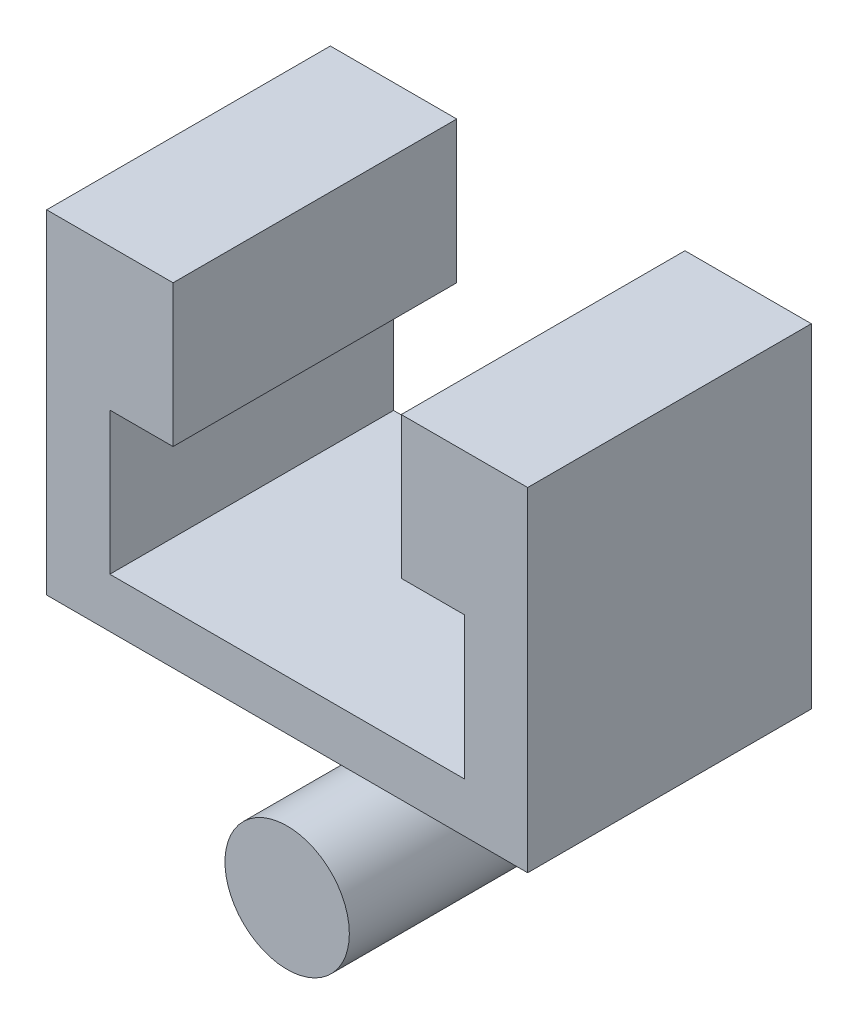
from build123d import *

# Parameters (mm, degrees)
BOSS_EXTRUDE1_DEPTH = 2.521826736
SKETCH2_R           = 11.136118556
BOSS_EXTRUDE2_DEPTH = 50.8
SKETCH3_W           = 86.137031446
SKETCH3_H           = 59.748072355
BOSS_EXTRUDE3_DEPTH = 50.8
CUT_EXTRUDE1_DEPTH  = 109.100560925


with BuildPart() as part:
    # Sketch1 → Boss-Extrude1 (new body)
    with BuildSketch(Plane.XY):
        with BuildLine():
            Line((-11.136118556, 0), (-11.136118556, 25.4))
            Line((-11.136118556, 25.4), (11.136118556, 25.4))
            Line((11.136118556, 25.4), (11.136118556, 0))
            ThreePointArc((11.136118556, 0), (0, 11.136118556), (-11.136118556, 0))
        make_face()
    boss_extrude1 = extrude(amount=BOSS_EXTRUDE1_DEPTH)

    # Sketch2 → Boss-Extrude2 (add)
    with BuildSketch(Plane.XY):
        Circle(SKETCH2_R)
    extrude(amount=BOSS_EXTRUDE2_DEPTH)

    # Sketch3 → Boss-Extrude3 (add)
    with BuildSketch(Plane.XY):
        with Locations((0, 55.274036178)):
            Rectangle(SKETCH3_W, SKETCH3_H)
    extrude(amount=BOSS_EXTRUDE3_DEPTH)

    # Sketch4 → Cut-Extrude1 (cut, through all)
    with BuildSketch(Plane.XY.offset(50.8)):
        Polygon((20.431484277, 85.148072355), (20.431484277, 59.748072355), (31.75, 59.748072355), (31.75, 34.29), (-31.75, 34.29), (-31.75, 59.748072355), (-20.431484277, 59.748072355), (-20.431484277, 85.148072355), align=None)
    extrude(amount=-CUT_EXTRUDE1_DEPTH, mode=Mode.SUBTRACT)

    # Mirror1: Boss-Extrude1 across plane
    add(boss_extrude1.mirror(Plane(origin=(0, 0, 12.7), x_dir=(1, 0, 0), z_dir=(0, 0, -1))))


solid = part.part
